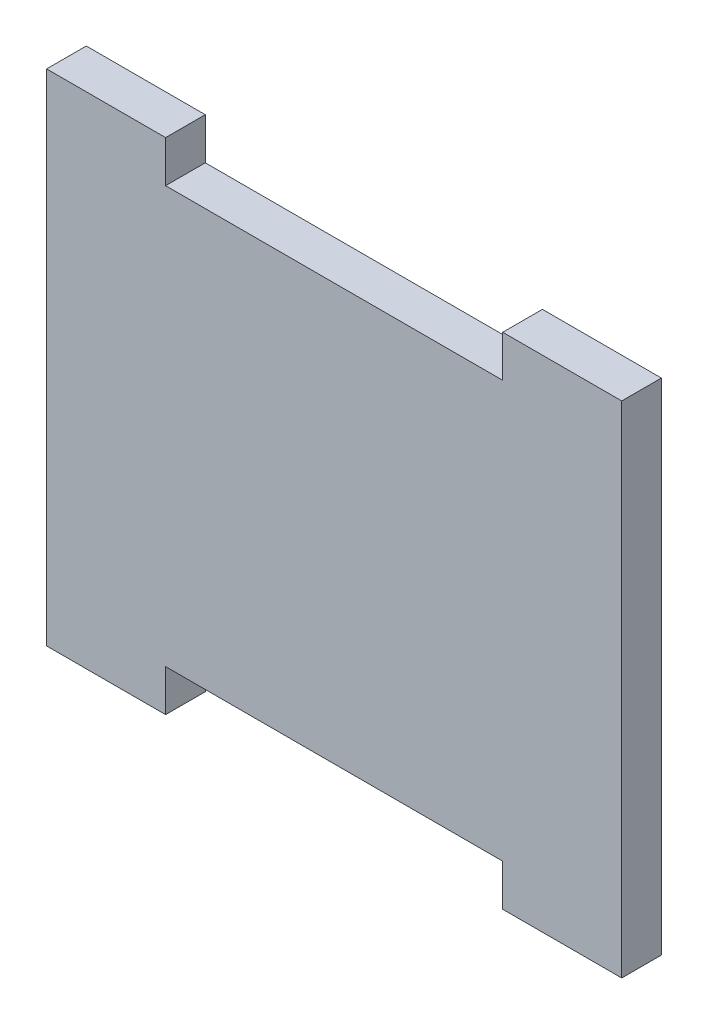
from build123d import *

# Parameters (mm, degrees)
SKETCH_2_W      = 29
SKETCH_2_H      = 21
SKETCH_2_W_2    = 6
SKETCH_2_H_2    = 2.1
EXTRUDE_1_DEPTH = 2


with BuildPart() as part:
    # 草图2 → 凸台-拉伸1 (new body)
    with BuildSketch(Plane.XY):
        with Locations((-10.082297853, 0)):
            Rectangle(SKETCH_2_W, SKETCH_2_H)
        with Locations((-21.582297853, 11.55)):
            Rectangle(SKETCH_2_W_2, SKETCH_2_H_2)
        with Locations((1.417702147, 11.55)):
            Rectangle(SKETCH_2_W_2, SKETCH_2_H_2)
        with Locations((-21.582297853, -11.55)):
            Rectangle(SKETCH_2_W_2, SKETCH_2_H_2)
        with Locations((1.417702147, -11.55)):
            Rectangle(SKETCH_2_W_2, SKETCH_2_H_2)
    extrude(amount=EXTRUDE_1_DEPTH)


solid = part.part
